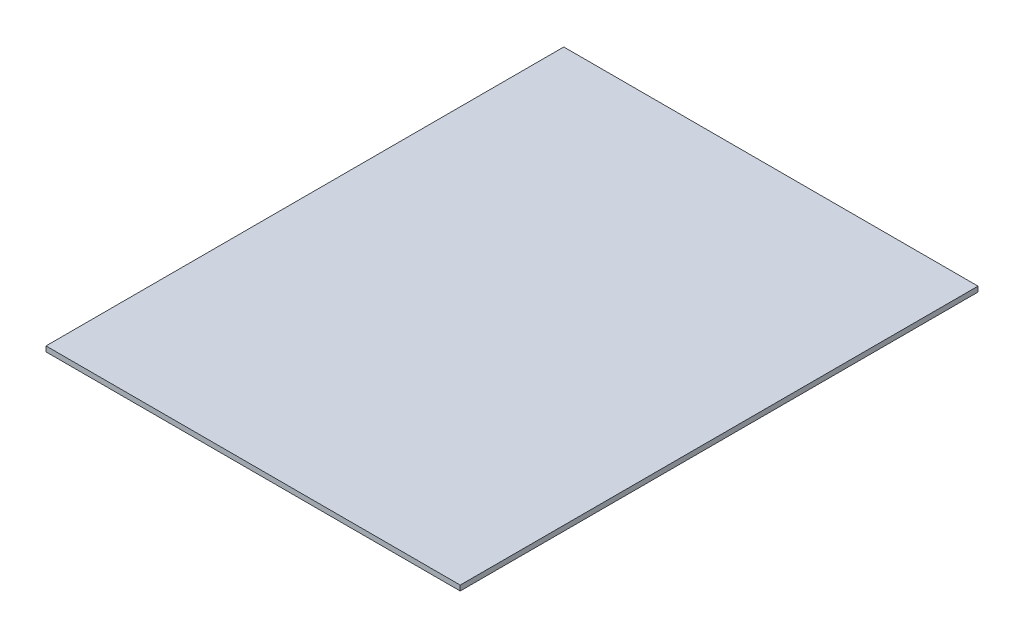
from build123d import *

# Parameters (mm, degrees)
SKETCH2_W           = 400
SKETCH2_H           = 500
BOSS_EXTRUDE1_DEPTH = 5


with BuildPart() as part:
    # Sketch2 → Boss-Extrude1 (new body)
    with BuildSketch(Plane(origin=(0, 0, 0), x_dir=(1, 0, 0), z_dir=(0, 1, 0))):
        Rectangle(SKETCH2_W, SKETCH2_H)
    extrude(amount=BOSS_EXTRUDE1_DEPTH)


solid = part.part
